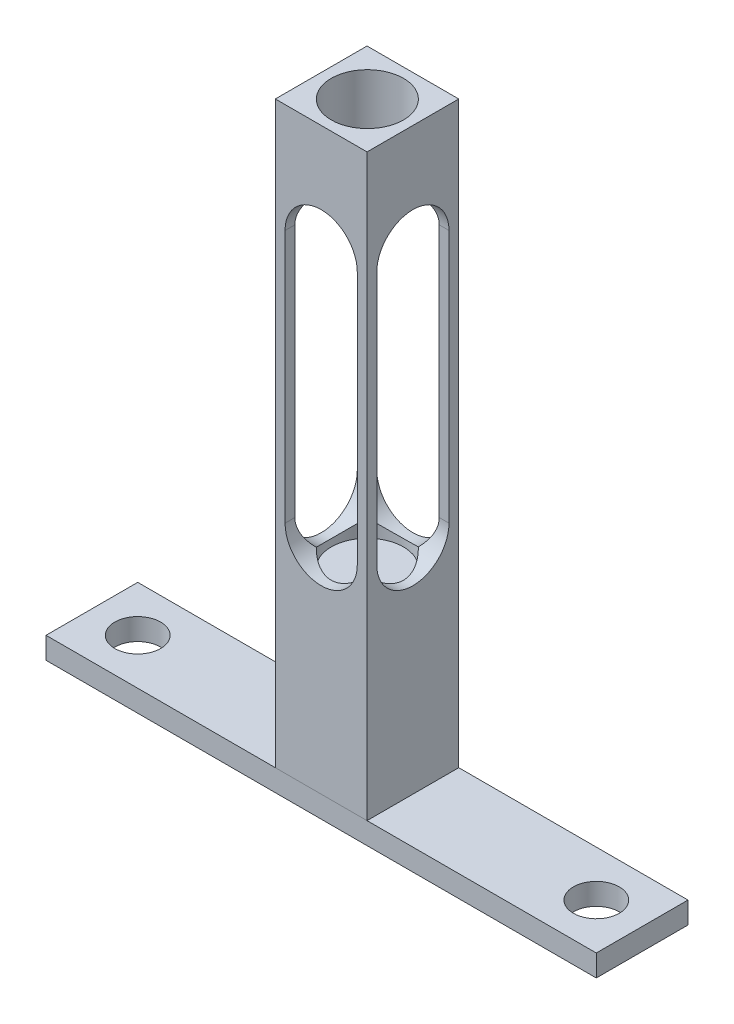
from build123d import *

# Parameters (mm, degrees)
SKETCH1_W           = 12.7
SKETCH1_H           = 80.2
BOSS_EXTRUDE1_DEPTH = 12.7
SKETCH4_W           = 76.2
SKETCH4_H           = 12.7
BOSS_EXTRUDE3_DEPTH = 3
CUT_EXTRUDE5_DEPTH  = 23
CUT_EXTRUDE6_DEPTH  = 23
SKETCH16_R          = 5
CUT_EXTRUDE8_DEPTH  = 56.2
SKETCH17_R          = 3.175
CUT_EXTRUDE9_DEPTH  = 3
SKETCH18_R          = 3.175
CUT_EXTRUDE10_DEPTH = 3


with BuildPart() as part:
    # Sketch1 → Boss-Extrude1 (new body)
    with BuildSketch(Plane.XY):
        with Locations((6.35, 40.1)):
            Rectangle(SKETCH1_W, SKETCH1_H)
    extrude(amount=BOSS_EXTRUDE1_DEPTH)

    # Sketch4 → Boss-Extrude3 (add)
    with BuildSketch(Plane(origin=(0, 0, 0), x_dir=(-1, 0, 0), z_dir=(0, -1, 0))):
        with Locations((-6.344193038, -6.349053499)):
            Rectangle(SKETCH4_W, SKETCH4_H)
    extrude(amount=BOSS_EXTRUDE3_DEPTH)

    # Sketch12 → Cut-Extrude5 (cut)
    with BuildSketch(Plane.XY.offset(12.7)):
        with BuildLine():
            Line((1.35, 30), (1.35, 65.1))
            ThreePointArc((1.35, 65.1), (6.35, 70.1), (11.35, 65.1))
            Line((11.35, 65.1), (11.35, 30))
            ThreePointArc((11.35, 30), (6.35, 25), (1.35, 30))
        make_face()
    extrude(amount=-CUT_EXTRUDE5_DEPTH, mode=Mode.SUBTRACT)

    # Sketch13 → Cut-Extrude6 (cut)
    with BuildSketch(Plane(origin=(12.7, 0, 0), x_dir=(0, 0, -1), z_dir=(1, 0, 0))):
        with BuildLine():
            Line((-11.35, 30), (-11.35, 65.1))
            ThreePointArc((-11.35, 65.1), (-6.35, 70.1), (-1.35, 65.1))
            Line((-1.35, 65.1), (-1.35, 30))
            ThreePointArc((-1.35, 30), (-6.35, 25), (-11.35, 30))
        make_face()
    extrude(amount=-CUT_EXTRUDE6_DEPTH, mode=Mode.SUBTRACT)

    # Sketch16 → Cut-Extrude8 (cut)
    with BuildSketch(Plane(origin=(0, 80.2, 0), x_dir=(1, 0, 0), z_dir=(0, 1, 0))):
        with Locations(Location((6.394331047, -6.34829435, 0), (0, 0, 270))):
            Circle(SKETCH16_R)
    extrude(amount=-CUT_EXTRUDE8_DEPTH, mode=Mode.SUBTRACT)

    # Sketch17 → Cut-Extrude9 (cut)
    with BuildSketch(Plane(origin=(0, 0, 0), x_dir=(1, 0, 0), z_dir=(0, 1, 0))):
        with Locations(Location((-25.405806962, -6.349053499, 0), (0, 0, 270))):
            Circle(SKETCH17_R)
    extrude(amount=-CUT_EXTRUDE9_DEPTH, mode=Mode.SUBTRACT)

    # Sketch18 → Cut-Extrude10 (cut)
    with BuildSketch(Plane(origin=(0, 0, 0), x_dir=(1, 0, 0), z_dir=(0, 1, 0))):
        with Locations(Location((38.1, -6.349053499, 0), (0, 0, 270))):
            Circle(SKETCH18_R)
    extrude(amount=-CUT_EXTRUDE10_DEPTH, mode=Mode.SUBTRACT)


solid = part.part
